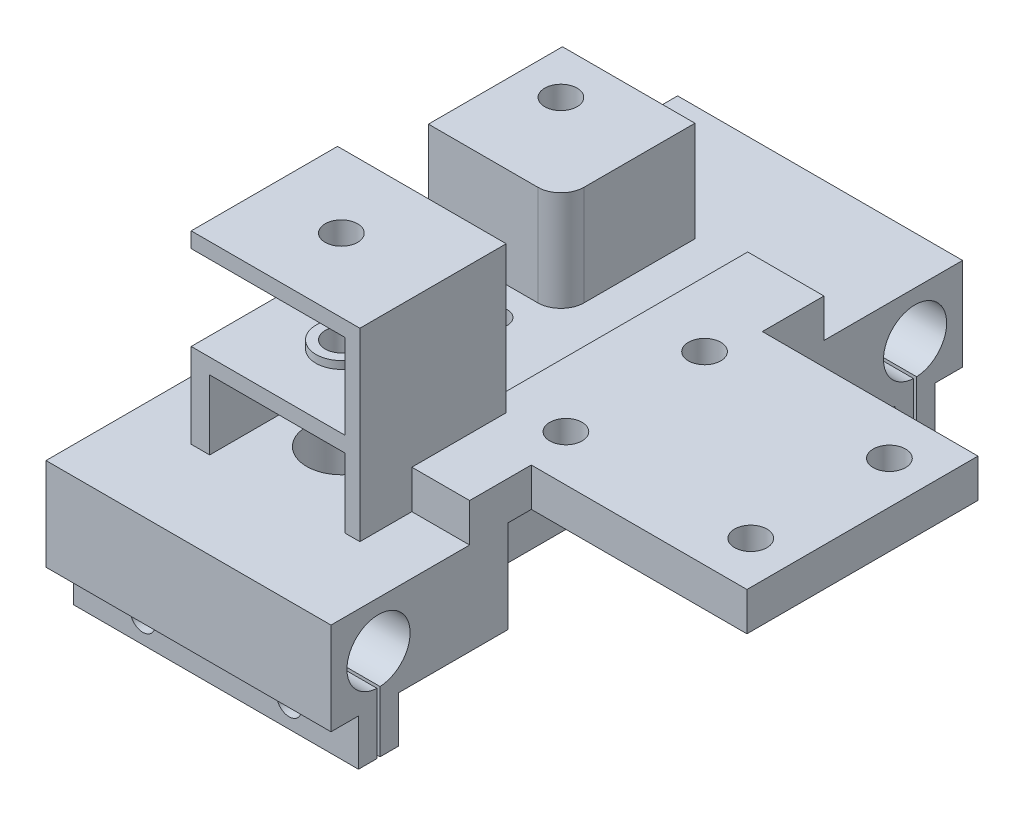
from build123d import *

# Parameters (mm, degrees)
SKETCH1_W            = 35
SKETCH1_H            = 30
SKETCH1_R            = 2.1
BOSS_EXTRUDE1_DEPTH  = 5
SKETCH2_W            = 30
SKETCH2_H            = 17
BOSS_EXTRUDE2_DEPTH  = 5
BOSS_EXTRUDE3_START  = -28
BOSS_EXTRUDE3_DEPTH  = 37
CUT_EXTRUDE1_REACH   = 66.542
CUT_EXTRUDE1_START   = -4.5
SKETCH5_W            = 36
SKETCH5_H            = 12.013565991
SKETCH6_W            = 2.1
SKETCH6_H            = 35.25
CUT_EXTRUDE2_DEPTH   = 5
SKETCH7_R            = 2.1
CUT_EXTRUDE3_DEPTH   = 17
SKETCH8_W            = 1.9
SKETCH8_H            = 19
SKETCH8_W_2          = 2.4
BOSS_EXTRUDE4_DEPTH  = 11
SKETCH9_W            = 9.9
SKETCH9_H            = 8
SKETCH9_W_2          = 7.5
BOSS_EXTRUDE5_DEPTH  = 5
BOSS_EXTRUDE6_DEPTH  = 2
BOSS_EXTRUDE7_START  = -13
SKETCH12_R           = 3.3
SKETCH12_R_2         = 2.1
BOSS_EXTRUDE7_DEPTH  = 1
BOSS_EXTRUDE8_START  = -23
SKETCH12_2_R         = 3.3
SKETCH12_2_R_2       = 2.1
BOSS_EXTRUDE8_DEPTH  = 1
SKETCH13_W           = 21.9
SKETCH13_H           = 19
BOSS_EXTRUDE9_DEPTH  = 2
SKETCH14_W           = 1.9
SKETCH14_H           = 19
BOSS_EXTRUDE10_DEPTH = 11
SKETCH15_W           = 21.9
SKETCH15_H           = 19
BOSS_EXTRUDE11_DEPTH = 2
CUT_EXTRUDE4_START   = -36
SKETCH16_R           = 2.1
CUT_EXTRUDE4_DEPTH   = 36
BOSS_EXTRUDE12_START = -2
SKETCH17_R           = 3.3
SKETCH17_R_2         = 2.1
BOSS_EXTRUDE12_DEPTH = 1
BOSS_EXTRUDE13_START = -12
SKETCH17_2_R         = 3.3
SKETCH17_2_R_2       = 2.1
BOSS_EXTRUDE13_DEPTH = 1
CUT_EXTRUDE5_REACH   = 74.341
SKETCH19_R           = 4.5
CUT_EXTRUDE6_REACH   = 69.181
SKETCH20_R           = 1.75
SKETCH21_R           = 1.6
CUT_EXTRUDE7_DEPTH   = 95.781405877


with BuildPart() as part:
    # Sketch1 → Boss-Extrude1 (new body)
    with BuildSketch(Plane(origin=(0, 0, 0), x_dir=(1, 0, 0), z_dir=(0, 1, 0))):
        Rectangle(SKETCH1_W, SKETCH1_H)
        with Locations(Location((12, 9, 0), (0, 0, 270))):
            Circle(SKETCH1_R, mode=Mode.SUBTRACT)
        with Locations(Location((12, -9, 0), (0, 0, 90))):
            Circle(SKETCH1_R, mode=Mode.SUBTRACT)
        with Locations(Location((-12, -9, 0), (0, 0, 270))):
            Circle(SKETCH1_R, mode=Mode.SUBTRACT)
        with Locations(Location((-12, 9, 0), (0, 0, 90))):
            Circle(SKETCH1_R, mode=Mode.SUBTRACT)
    extrude(amount=BOSS_EXTRUDE1_DEPTH)

    # Sketch2 → Boss-Extrude2 (add)
    with BuildSketch(Plane.ZY.offset(17.5)):
        with Locations((0, -3.5)):
            Rectangle(SKETCH2_W, SKETCH2_H)
    extrude(amount=BOSS_EXTRUDE2_DEPTH)

    # Sketch3 → Boss-Extrude3 (add)
    with BuildSketch(Plane(origin=(17.5, 0, 0), x_dir=(0, 0, -1), z_dir=(1, 0, 0)).offset(BOSS_EXTRUDE3_START)):
        with BuildLine():
            Line((-41, 0), (41, 0))
            Line((41, 0), (41, -12))
            Line((41, -12), (37.43, -12))
            Line((37.43, -12), (37.43, -18))
            Line((37.43, -18), (35.03, -18))
            Line((35.03, -18), (35.03, -12))
            Line((35.03, -12), (35.03, -10.095119046))
            ThreePointArc((35.03, -10.095119046), (34.83, -1.9), (34.63, -10.095119046))
            Line((34.63, -10.095119046), (34.63, -12))
            Line((34.63, -12), (34.63, -18))
            Line((34.63, -18), (32.23, -18))
            Line((32.23, -18), (32.23, -12))
            Line((32.23, -12), (-32.23, -12))
            Line((-32.23, -12), (-32.23, -18))
            Line((-32.23, -18), (-34.63, -18))
            Line((-34.63, -18), (-34.63, -12))
            Line((-34.63, -12), (-34.63, -10.095119046))
            ThreePointArc((-34.63, -10.095119046), (-34.83, -1.9), (-35.03, -10.095119046))
            Line((-35.03, -10.095119046), (-35.03, -12))
            Line((-35.03, -12), (-35.03, -18))
            Line((-35.03, -18), (-37.43, -18))
            Line((-37.43, -18), (-37.43, -12))
            Line((-37.43, -12), (-41, -12))
            Line((-41, -12), (-41, 0))
        make_face()
    extrude(amount=-BOSS_EXTRUDE3_DEPTH)

    # Sketch5 → Cut-Extrude1 (cut, up to next)
    with BuildSketch(Plane.ZY.offset(22.5).offset(CUT_EXTRUDE1_START), mode=Mode.PRIVATE) as cut_extrude1_sk1:
        with Locations((0, -5.993217004)):
            Rectangle(SKETCH5_W, SKETCH5_H)
    cut_extrude1_tool1 = extrude(cut_extrude1_sk1.sketch, amount=-CUT_EXTRUDE1_REACH, mode=Mode.PRIVATE) & part.part
    add(cut_extrude1_tool1.solids().sort_by_distance((-18, -5.993217, 0))[0], mode=Mode.SUBTRACT)

    # Sketch6 → Cut-Extrude2 (cut)
    with BuildSketch(Plane(origin=(0, 5, 0), x_dir=(1, 0, 0), z_dir=(0, 1, 0))):
        with Locations((-21.45, -2.625)):
            Rectangle(SKETCH6_W, SKETCH6_H)
    extrude(amount=-CUT_EXTRUDE2_DEPTH, mode=Mode.SUBTRACT)

    # Sketch7 → Cut-Extrude3 (cut)
    with BuildSketch(Plane(origin=(0, 5, 0), x_dir=(1, 0, 0), z_dir=(0, 1, 0))):
        with Locations(Location((-29.9, -20.25, 0), (0, 0, 270))):
            Circle(SKETCH7_R)
        with Locations(Location((-41.9, 20.25, 0), (0, 0, 270))):
            Circle(SKETCH7_R)
    extrude(amount=-CUT_EXTRUDE3_DEPTH, mode=Mode.SUBTRACT)

    # Sketch8 → Boss-Extrude4 (add)
    with BuildSketch(Plane(origin=(0, 0, 0), x_dir=(1, 0, 0), z_dir=(0, 1, 0))):
        with BuildLine():
            Line((-47.5, 10.25), (-34.9, 10.25))
            ThreePointArc((-34.9, 10.25), (-32.778679656, 11.128679656), (-31.9, 13.25))
            Line((-31.9, 13.25), (-31.9, 26.051552427))
            Line((-31.9, 26.051552427), (-30.3, 26.051552427))
            Line((-30.3, 26.051552427), (-30.3, 11.65))
            ThreePointArc((-30.3, 11.65), (-31.178679656, 9.528679656), (-33.3, 8.65))
            Line((-33.3, 8.65), (-47.5, 8.65))
            Line((-47.5, 8.65), (-47.5, 10.25))
        make_face()
        with Locations((-18.95, -20.25)):
            Rectangle(SKETCH8_W, SKETCH8_H)
        with Locations((-38.7, -20.25)):
            Rectangle(SKETCH8_W_2, SKETCH8_H)
    extrude(amount=BOSS_EXTRUDE4_DEPTH)

    # Sketch9 → Boss-Extrude5 (add)
    with BuildSketch(Plane(origin=(0, 0, 0), x_dir=(1, 0, 0), z_dir=(0, 1, 0))):
        with Locations((-15.45, 19)):
            Rectangle(SKETCH9_W, SKETCH9_H)
        with Locations((-14.25, -19)):
            Rectangle(SKETCH9_W_2, SKETCH9_H)
    extrude(amount=BOSS_EXTRUDE5_DEPTH)

    # Sketch10 → Boss-Extrude6 (add)
    with BuildSketch(Plane(origin=(0, 11, 0), x_dir=(1, 0, 0), z_dir=(0, 1, 0))):
        with BuildLine():
            Line((-30.3, 26.051552427), (-47.5, 26.051552427))
            Line((-47.5, 26.051552427), (-47.5, 8.65))
            Line((-47.5, 8.65), (-33.3, 8.65))
            ThreePointArc((-33.3, 8.65), (-31.178679656, 9.528679656), (-30.3, 11.65))
            Line((-30.3, 11.65), (-30.3, 26.051552427))
        make_face()
    extrude(amount=BOSS_EXTRUDE6_DEPTH)

    # Sketch12 → Boss-Extrude7 (add)
    with BuildSketch(Plane.XZ.offset(12).offset(BOSS_EXTRUDE7_START)):
        with Locations(Location((-41.9, -20.25, 0), (0, 0, 270))):
            Circle(SKETCH12_R)
        with Locations(Location((-41.9, -20.25, 0), (0, 0, 90))):
            Circle(SKETCH12_R_2, mode=Mode.SUBTRACT)
    extrude(amount=BOSS_EXTRUDE7_DEPTH)

    # Sketch12<2> → Boss-Extrude8 (add)
    with BuildSketch(Plane.XZ.offset(12).offset(BOSS_EXTRUDE8_START)):
        with Locations(Location((-41.9, -20.25, 0), (0, 0, 270))):
            Circle(SKETCH12_2_R)
        with Locations(Location((-41.9, -20.25, 0), (0, 0, 90))):
            Circle(SKETCH12_2_R_2, mode=Mode.SUBTRACT)
    extrude(amount=BOSS_EXTRUDE8_DEPTH)

    # Sketch13 → Boss-Extrude9 (add)
    with BuildSketch(Plane(origin=(0, 11, 0), x_dir=(1, 0, 0), z_dir=(0, 1, 0))):
        with Locations((-28.95, -20.25)):
            Rectangle(SKETCH13_W, SKETCH13_H)
    extrude(amount=-BOSS_EXTRUDE9_DEPTH)

    # Sketch14 → Boss-Extrude10 (add)
    with BuildSketch(Plane(origin=(0, 11, 0), x_dir=(1, 0, 0), z_dir=(0, 1, 0))):
        with Locations((-18.95, -20.25)):
            Rectangle(SKETCH14_W, SKETCH14_H)
    extrude(amount=BOSS_EXTRUDE10_DEPTH)

    # Sketch15 → Boss-Extrude11 (add)
    with BuildSketch(Plane(origin=(0, 22, 0), x_dir=(1, 0, 0), z_dir=(0, 1, 0))):
        with Locations((-28.95, -20.25)):
            Rectangle(SKETCH15_W, SKETCH15_H)
    extrude(amount=BOSS_EXTRUDE11_DEPTH)

    # Sketch16 → Cut-Extrude4 (cut)
    with BuildSketch(Plane.XZ.offset(12).offset(CUT_EXTRUDE4_START)):
        with Locations(Location((-29.9, 20.25, 0), (0, 0, 90))):
            Circle(SKETCH16_R)
        with Locations(Location((-41.9, -20.25, 0), (0, 0, 90))):
            Circle(SKETCH16_R)
    extrude(amount=CUT_EXTRUDE4_DEPTH, mode=Mode.SUBTRACT)

    # Sketch17 → Boss-Extrude12 (add)
    with BuildSketch(Plane(origin=(0, 24, 0), x_dir=(1, 0, 0), z_dir=(0, 1, 0)).offset(BOSS_EXTRUDE12_START)):
        with Locations(Location((-29.9, -20.25, 0), (0, 0, 270))):
            Circle(SKETCH17_R)
        with Locations(Location((-29.9, -20.25, 0), (0, 0, 270))):
            Circle(SKETCH17_R_2, mode=Mode.SUBTRACT)
    extrude(amount=-BOSS_EXTRUDE12_DEPTH)

    # Sketch17<2> → Boss-Extrude13 (add)
    with BuildSketch(Plane(origin=(0, 24, 0), x_dir=(1, 0, 0), z_dir=(0, 1, 0)).offset(BOSS_EXTRUDE13_START)):
        with Locations(Location((-29.9, -20.25, 0), (0, 0, 270))):
            Circle(SKETCH17_2_R)
        with Locations(Location((-29.9, -20.25, 0), (0, 0, 270))):
            Circle(SKETCH17_2_R_2, mode=Mode.SUBTRACT)
    extrude(amount=-BOSS_EXTRUDE13_DEPTH)

    # Sketch19 → Cut-Extrude5 (cut, up to next)
    with BuildSketch(Plane.XZ.offset(12), mode=Mode.PRIVATE) as cut_extrude5_sk1:
        with Locations(Location((-29.9, 20.25, 0), (0, 0, 270))):
            Circle(SKETCH19_R)
    cut_extrude5_tool1 = extrude(cut_extrude5_sk1.sketch, amount=-CUT_EXTRUDE5_REACH, mode=Mode.PRIVATE) & part.part
    add(cut_extrude5_tool1.solids().sort_by_distance((-29.9, -12, 20.25))[0], mode=Mode.SUBTRACT)

    # Sketch20 → Cut-Extrude6 (cut, up to next)
    with BuildSketch(Plane(origin=(0, 0, 0), x_dir=(1, 0, 0), z_dir=(0, 1, 0)), mode=Mode.PRIVATE) as cut_extrude6_sk1:
        with Locations(Location((-34.5, 4.15, 0), (0, 0, 270))):
            Circle(SKETCH20_R)
    cut_extrude6_tool1 = extrude(cut_extrude6_sk1.sketch, amount=-CUT_EXTRUDE6_REACH, mode=Mode.PRIVATE) & part.part
    # Sketch20 → Cut-Extrude6 (cut, up to next)
    with BuildSketch(Plane(origin=(0, 0, 0), x_dir=(1, 0, 0), z_dir=(0, 1, 0)), mode=Mode.PRIVATE) as cut_extrude6_sk2:
        with Locations(Location((-44.5, -17.85, 0), (0, 0, 270))):
            Circle(SKETCH20_R)
    cut_extrude6_tool2 = extrude(cut_extrude6_sk2.sketch, amount=-CUT_EXTRUDE6_REACH, mode=Mode.PRIVATE) & part.part
    add(cut_extrude6_tool1.solids().sort_by_distance((-34.5, 0, -4.15))[0], mode=Mode.SUBTRACT)
    add(cut_extrude6_tool2.solids().sort_by_distance((-44.5, 0, 17.85))[0], mode=Mode.SUBTRACT)

    # Sketch21 → Cut-Extrude7 (cut, through all)
    with BuildSketch(Plane(origin=(0, 0, -37.43), x_dir=(-1, 0, 0), z_dir=(0, 0, -1))):
        with Locations((19.5, -15)):
            Circle(SKETCH21_R)
        with Locations((38.5, -15)):
            Circle(SKETCH21_R)
    extrude(amount=-CUT_EXTRUDE7_DEPTH, mode=Mode.SUBTRACT)


solid = part.part
